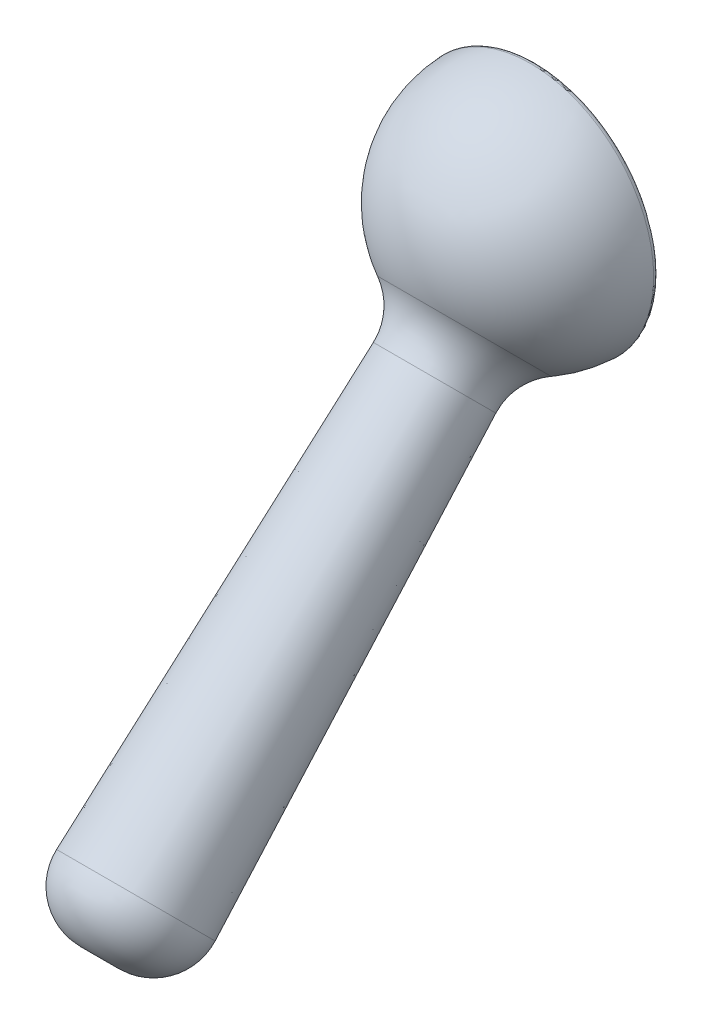
from build123d import *

# Parameters (mm, degrees)
SKETCH3_R                     = 10
BOSS_EXTRUDE1_DEPTH           = 100
BOSS_EXTRUDE1_TAPER           = -2
BOSS_EXTRUDE1_OTHER_WAY_DEPTH = 2.5
BOSS_EXTRUDE1_OTHER_WAY_TAPER = -2
FILLET1_R                     = 10
FILLET2_R                     = 10
FILLET3_R                     = 1


with BuildPart() as part:
    # Sketch1 → Revolve1 (revolve)
    with BuildSketch(Plane.YZ):
        with BuildLine():
            Line((0, 25), (0, 20))
            ThreePointArc((0, 20), (14.142135624, 14.142135624), (20, 0))
            Line((20, 0), (25, 0))
            ThreePointArc((25, 0), (17.67766953, 17.67766953), (0, 25))
        make_face()
    revolve(axis=Axis((0, 0, 25), (0, 0, -1)))

    # Sketch3 → Boss-Extrude1 (add)
    with BuildSketch(Plane(origin=(0, -17.67766953, 17.67766953), x_dir=(-1, 0, 0), z_dir=(0, -0.7071067811865513, 0.7071067811865438))):
        Circle(SKETCH3_R)
    extrude(amount=BOSS_EXTRUDE1_DEPTH, taper=BOSS_EXTRUDE1_TAPER)

    # Sketch3 → Boss-Extrude1 other way (add)
    with BuildSketch(Plane(origin=(0, -17.67766953, 17.67766953), x_dir=(-1, 0, 0), z_dir=(0, -0.7071067811865513, 0.7071067811865438))):
        Circle(SKETCH3_R)
    extrude(amount=-BOSS_EXTRUDE1_OTHER_WAY_DEPTH, taper=BOSS_EXTRUDE1_OTHER_WAY_TAPER)

    # Fillet1
    fillet1_edges = [part.edges().sort_by_distance(p)[0] for p in [
        (13.492076949, -88.388347648, 88.388347648),
    ]]
    fillet(fillet1_edges, radius=FILLET1_R)

    # Fillet2
    fillet2_edges = [part.edges().sort_by_distance(p)[0] for p in [
        (10.074016935, -16.17890888, 16.178908809),
    ]]
    fillet(fillet2_edges, radius=FILLET2_R)

    # Fillet3
    fillet3_edges = [part.edges().sort_by_distance(p)[0] for p in [
        (0, -25, 0),
    ]]
    fillet(fillet3_edges, radius=FILLET3_R)


solid = part.part
